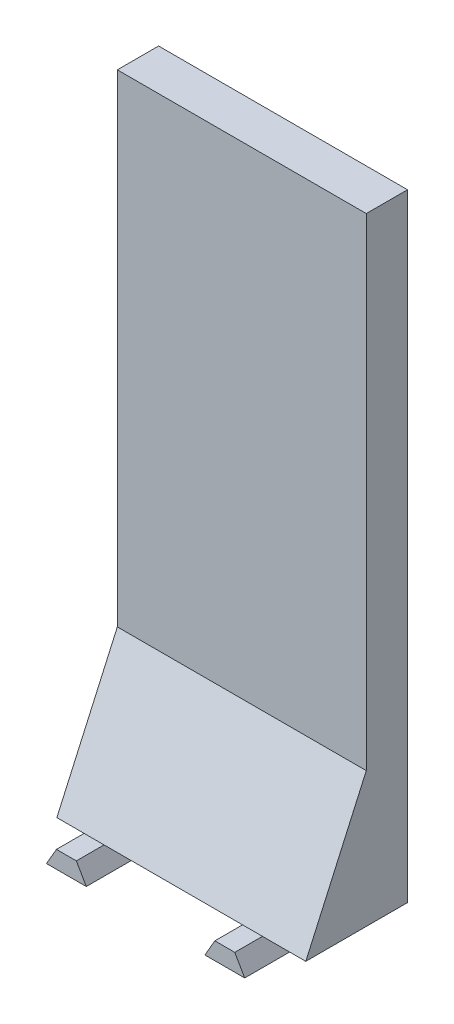
from build123d import *

# Parameters (mm, degrees)
SKETCH1_W             = 25
SKETCH1_H             = 2
BOSS_EXTRUDE1_DEPTH   = 20
BOSS_EXTRUDE2_DEPTH   = 15
BOSS_EXTRUDE2_2_DEPTH = 15
SKETCH4_W             = 25
SKETCH4_H             = 13
BOSS_EXTRUDE3_DEPTH   = 60
CUT_EXTRUDE1_DEPTH    = 25
SKETCH6_W             = 7
SKETCH6_H             = 2.009284039
CUT_EXTRUDE3_DEPTH    = 25
SKETCH8_W             = 5
SKETCH8_H             = 4
BOSS_EXTRUDE5_DEPTH   = 6
SKETCH11_W            = 1.25
SKETCH11_H            = 7.630869725


with BuildPart() as part:
    # Sketch1 → Boss-Extrude1 (new body)
    with BuildSketch(Plane.XY):
        with Locations((689.05616553, 898.870768954)):
            Rectangle(SKETCH1_W, SKETCH1_H)
    extrude(amount=BOSS_EXTRUDE1_DEPTH)

    # Sketch4 → Boss-Extrude3 (add)
    with BuildSketch(Plane(origin=(0, 899.870768954, 0), x_dir=(1, 0, 0), z_dir=(0, 1, 0))):
        with Locations((689.05616553, -13.5)):
            Rectangle(SKETCH4_W, SKETCH4_H)
    extrude(amount=BOSS_EXTRUDE3_DEPTH)

    # Sketch5 → Cut-Extrude1 (cut)
    with BuildSketch(Plane.ZY.offset(-676.55616553)):
        Polygon((11.143111538, 959.870768954), (20, 959.870768954), (20, 897.870768954), (17.217418277, 897.870768954), (11.143111538, 911.420968004), align=None)
    extrude(amount=-CUT_EXTRUDE1_DEPTH, mode=Mode.SUBTRACT)


with BuildPart() as body_2:
    # Sketch2 → Boss-Extrude2 (new body)
    with BuildSketch(Plane.XY.offset(20)):
        Polygon((679.296852935, 897.870768954), (678.296852935, 896.138718147), (682.296852935, 896.138718147), (681.296852935, 897.870768954), align=None)
    extrude(amount=-BOSS_EXTRUDE2_DEPTH)


with BuildPart() as body_3:
    # Sketch2 → Boss-Extrude2 2 (new body)
    with BuildSketch(Plane.XY.offset(20)):
        Polygon((697.20561018, 897.870768954), (695.20561018, 897.870768954), (694.20561018, 896.138718147), (698.20561018, 896.138718147), align=None)
    extrude(amount=-BOSS_EXTRUDE2_2_DEPTH)


with BuildPart() as cut_extrude3_tool:
    # Sketch6 → Cut-Extrude3 (new body)
    with BuildSketch(Plane.ZY.offset(-676.55616553)):
        with Locations((3.5, 898.866126935)):
            Rectangle(SKETCH6_W, SKETCH6_H)
    extrude(amount=-CUT_EXTRUDE3_DEPTH)


with BuildPart() as part_1:
    add(part.part)

    # Cut-Extrude3: cut by cut_extrude3_tool
    add(cut_extrude3_tool.part, mode=Mode.SUBTRACT)

    # Sketch8 → Boss-Extrude5 (add)
    with BuildSketch(Plane(origin=(0, 0, 7), x_dir=(-1, 0, 0), z_dir=(0, 0, -1))):
        with Locations((-689.05616553, 901.769587872)):
            Rectangle(SKETCH8_W, SKETCH8_H)
    extrude(amount=BOSS_EXTRUDE5_DEPTH)

    # Sketch11 → Ø2.5 (2.5) Diameter Hole1 (revolve, cut)
    with BuildSketch(Plane(origin=(689.05616553, 903.769587872, 3.5), x_dir=(0, 0, 1), z_dir=(1, 0, 0))):
        with Locations((0.625, 3.815434863)):
            Rectangle(SKETCH11_W, SKETCH11_H)
    revolve(axis=Axis((689.05616553, 910.119587872, 3.5), (0, -1, 0)), mode=Mode.SUBTRACT)


with BuildPart() as body_2_1:
    add(body_2.part)

    # Cut-Extrude3: cut by cut_extrude3_tool
    add(cut_extrude3_tool.part, mode=Mode.SUBTRACT)


with BuildPart() as body_3_1:
    add(body_3.part)

    # Cut-Extrude3: cut by cut_extrude3_tool
    add(cut_extrude3_tool.part, mode=Mode.SUBTRACT)


solid = Compound([part_1.part, body_2_1.part, body_3_1.part])
